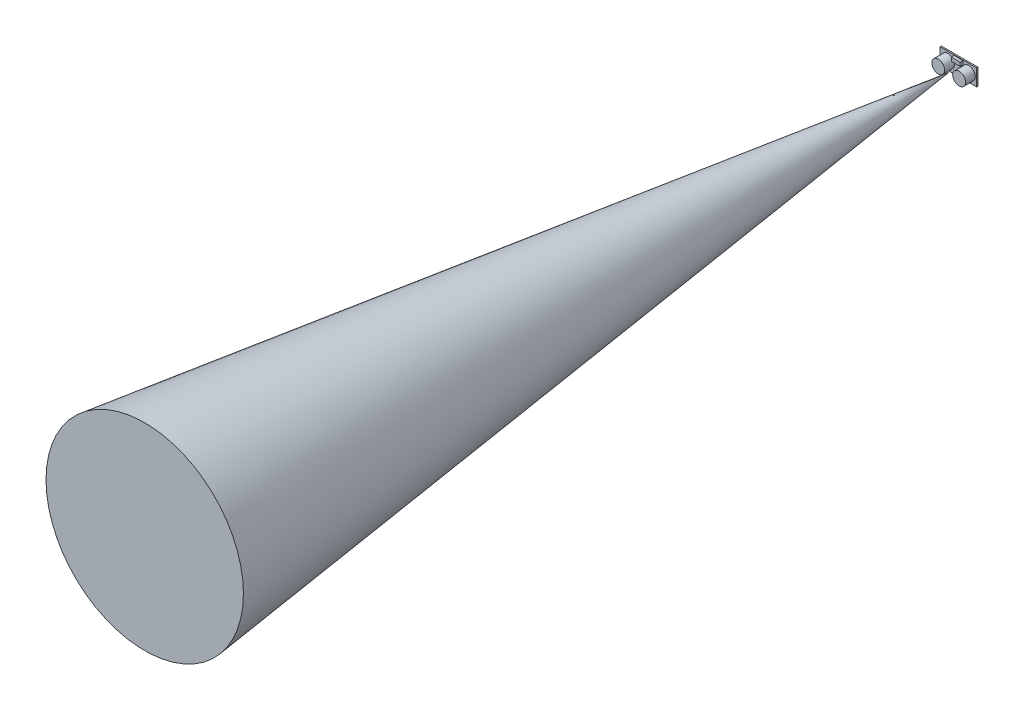
from build123d import *

# Parameters (mm, degrees)
SKIZZE1_W                       = 45.5
SKIZZE1_H                       = 20.6
AUFSATZ_LINEAR_AUSTRAGEN1_DEPTH = 1.6
SKIZZE2_R                       = 8
AUFSATZ_LINEAR_AUSTRAGEN2_DEPTH = 12.1
SKIZZE3_W                       = 11
SKIZZE3_H                       = 4.6
AUFSATZ_LINEAR_AUSTRAGEN3_DEPTH = 3.4
SKIZZE4_W                       = 0.7
SKIZZE4_H                       = 0.7
AUFSATZ_LINEAR_AUSTRAGEN4_DEPTH = 6.4
SKIZZE5_W                       = 0.7
SKIZZE5_H                       = 0.7
AUFSATZ_LINEAR_AUSTRAGEN5_DEPTH = 6.9


with BuildPart() as part:
    # Skizze1 → Aufsatz-Linear austragen1 (new body)
    with BuildSketch(Plane.XY):
        with Locations((22.75, 10.3)):
            Rectangle(SKIZZE1_W, SKIZZE1_H)
    extrude(amount=-AUFSATZ_LINEAR_AUSTRAGEN1_DEPTH)

    # Skizze2 → Aufsatz-Linear austragen2 (add)
    with BuildSketch(Plane.XY):
        with Locations(Location((9.75, 10.3, 0), (0, 0, 180))):
            Circle(SKIZZE2_R)
        with Locations(Location((35.75, 10.3, 0), (0, 0, 180))):
            Circle(SKIZZE2_R)
    extrude(amount=AUFSATZ_LINEAR_AUSTRAGEN2_DEPTH)

    # Skizze3 → Aufsatz-Linear austragen3 (add)
    with BuildSketch(Plane.XY):
        with Locations((22.75, 17.6)):
            Rectangle(SKIZZE3_W, SKIZZE3_H)
    extrude(amount=AUFSATZ_LINEAR_AUSTRAGEN3_DEPTH)

    # Skizze4 → Aufsatz-Linear austragen4 (add)
    with BuildSketch(Plane(origin=(0, 0, -1.6), x_dir=(-1, 0, 0), z_dir=(0, 0, -1))):
        with Locations((-26.55, 2.3)):
            Rectangle(SKIZZE4_W, SKIZZE4_H)
        with Locations((-24.016666667, 2.3)):
            Rectangle(SKIZZE4_W, SKIZZE4_H)
        with Locations((-21.483333333, 2.3)):
            Rectangle(SKIZZE4_W, SKIZZE4_H)
        with Locations((-18.95, 2.3)):
            Rectangle(SKIZZE4_W, SKIZZE4_H)
    extrude(amount=AUFSATZ_LINEAR_AUSTRAGEN4_DEPTH)

    # Skizze5 → Aufsatz-Linear austragen5 (add)
    with BuildSketch(Plane.XZ.offset(-1.95)):
        with Locations((26.55, -7.65)):
            Rectangle(SKIZZE5_W, SKIZZE5_H)
        with Locations((24.016666667, -7.65)):
            Rectangle(SKIZZE5_W, SKIZZE5_H)
        with Locations((21.483333333, -7.65)):
            Rectangle(SKIZZE5_W, SKIZZE5_H)
        with Locations((18.95, -7.65)):
            Rectangle(SKIZZE5_W, SKIZZE5_H)
    extrude(amount=AUFSATZ_LINEAR_AUSTRAGEN5_DEPTH)


with BuildPart() as body_2:
    # Skizze6 → Rotation2 (revolve)
    with BuildSketch(Plane.ZY.offset(-22.75), mode=Mode.PRIVATE) as rotation2_sk:
        Polygon((12.1, 10.3), (1012.1, 10.3), (1012.1, -112.484560903), align=None)
    revolve(rotation2_sk.sketch.rotate(Axis((22.75, 10.3, 12.1), (0, 0, 1)), 90), axis=Axis((22.75, 10.3, 12.1), (0, 0, 1)))


solid = Compound([part.part, body_2.part])
